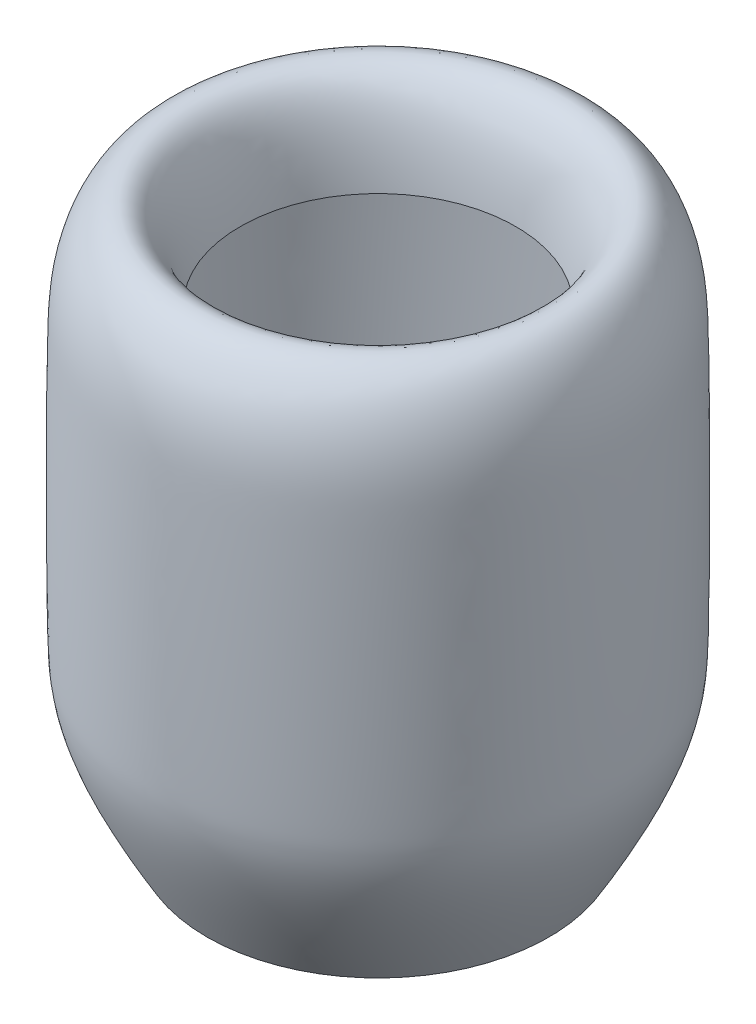
from build123d import *


with BuildPart() as part:
    # Sketch1 → Revolve1 (revolve)
    with BuildSketch(Plane.XY, mode=Mode.PRIVATE) as revolve1_sk:
        with BuildLine():
            Line((55, -150), (55.864024026, -150.503450576))
            add(Edge.make_bspline(
                [(45.00654715, 0.114242876), (45.06482757, 0.621047776), (45.18851775, 1.644460519), (45.449476223, 3.604534474), (45.807109076, 5.951302739), (46.282175802, 8.587277687), (46.974586794, 11.87284442), (47.944891454, 15.556110412), (49.260798878, 19.327399197), (50.71426174, 22.479202135), (52.822531276, 25.890737105), (55.762438214, 28.752400148), (59.775616352, 29.944703091), (63.735411013, 28.855964426), (67.272310325, 25.993185479), (70.384049491, 21.659198301), (72.968670827, 16.049508725), (74.908223827, 9.354436921), (76.006528055, 1.781881661), (76.311133894, -6.501339013), (76.445466907, -15.82130644), (76.559676902, -26.07226948), (76.624078217, -36.850121223), (76.659503219, -51.472599903), (76.621324876, -65.762266047), (76.523261527, -78.31217141), (76.422750358, -86.503967208), (76.319341067, -92.017255526), (76.225951493, -95.474691226), (76.126991356, -98.213222787), (75.980332868, -100.516841803), (75.726389583, -102.804562872), (75.32570475, -105.691817603), (74.621297046, -109.202041189), (73.473579764, -113.466672248), (71.73946293, -118.597826519), (69.687111884, -123.698544356), (67.609264094, -128.335514056), (65.814911511, -132.10705832), (63.766745899, -136.187722813), (61.833022305, -139.85953744), (60.141797292, -142.965951038), (58.796671742, -145.386184345), (57.382072923, -147.882500868), (56.367441397, -149.639483537), (55.864024026, -150.503450576)],
                knots=[0, 0, 0, 0, 0.00390625, 0.0078125, 0.015625, 0.0234375, 0.03125, 0.046875, 0.0625, 0.078125, 0.09375, 0.125, 0.15625, 0.1875, 0.21875, 0.25, 0.28125, 0.3125, 0.34375, 0.375, 0.40625, 0.4375, 0.46875, 0.5, 0.5625, 0.59375, 0.625, 0.65625, 0.671875, 0.6875, 0.71875, 0.75, 0.78125, 0.8125, 0.84375, 0.875, 0.90625, 0.921875, 0.9375, 0.953125, 0.96875, 0.9765625, 0.984375, 0.9921875, 1, 1, 1, 1], degree=3))
            Line((45.00654715, 0.114242876), (46, 0))
            add(Edge.make_bspline(
                [(46, 0), (50.9933971, 43.422441349), (74.419231037, 29.066702517), (75.887608065, -30.170664842), (75.613452989, -93.029990368), (74.522170097, -105.896749327), (71.853744098, -121.075532478), (55, -150)],
                knots=[0, 0, 0, 0, 0.332423256, 0.386421074, 0.677937349, 0.742939195, 1, 1, 1, 1], degree=3))
        make_face()
    revolve(revolve1_sk.sketch.rotate(Axis((0, 0, 0), (0, -1, 0)), 90), axis=Axis((0, 0, 0), (0, -1, 0)))


solid = part.part
